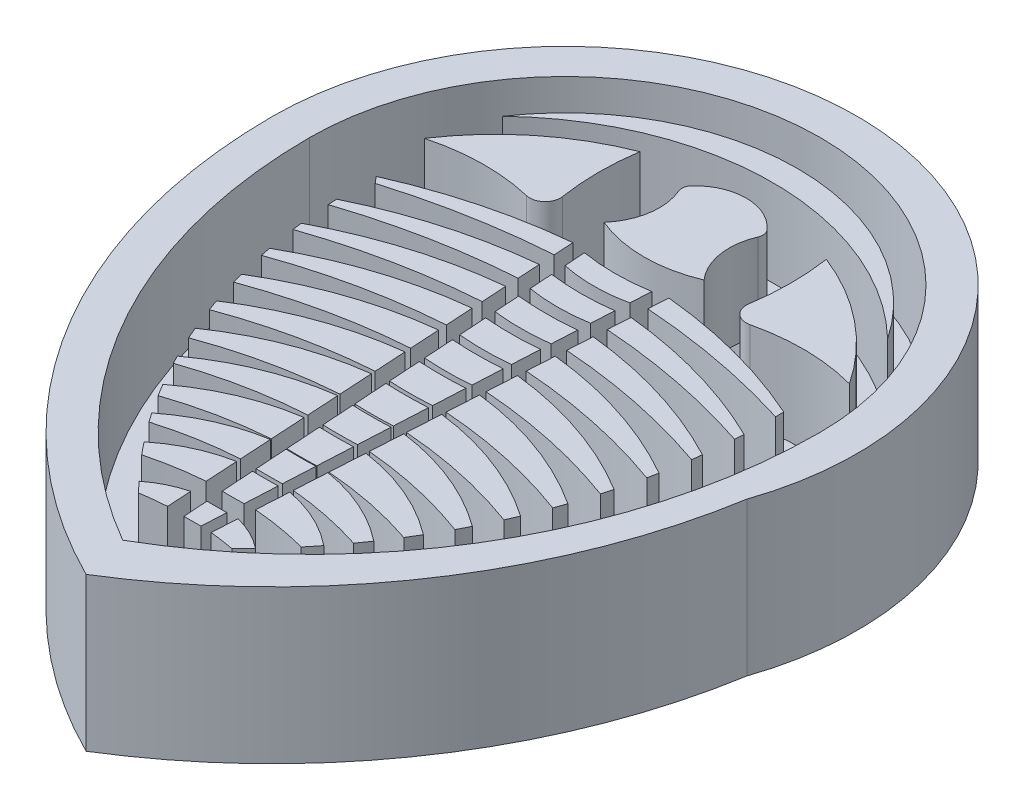
from build123d import *

# Parameters (mm, degrees)
P_IDAT_VYSUNUT_M1_DEPTH = 1
P_IDAT_VYSUNUT_M2_DEPTH = 1.7
BOSS_EXTRUDE1_START     = -3
BOSS_EXTRUDE1_DEPTH     = 3


with BuildPart() as part:
    # Skica1 → Přidat vysunutím1 (new body)
    with BuildSketch(Plane(origin=(0, 0, 0), x_dir=(1, 0, 0), z_dir=(0, 1, 0))):
        with BuildLine():
            ThreePointArc((5, 0), (0, 5), (-5, 0))
            ThreePointArc((-5, 0), (-3.660254038, -5), (0, -8.660254038))
            ThreePointArc((0, -8.660254038), (3.660254038, -5), (5, 0))
        make_face()
        with BuildLine():
            Line((3.521195323, 0.745878365), (3.521195323, -1.05683578))
            ThreePointArc((3.521195323, -1.05683578), (2.665209016, -2.296570998), (2.915739681, -3.782131617))
            Line((2.915739681, -3.782131617), (1.735980446, -4.961890852))
            ThreePointArc((1.735980446, -4.961890852), (1.139962306, -1.642409891), (3.521195323, 0.745878365))
        make_face(mode=Mode.SUBTRACT)
        with BuildLine():
            Line((-3.48910503, 0.731222327), (-3.48910503, -1.078343694))
            ThreePointArc((-3.48910503, -1.078343694), (-2.661110904, -2.315447133), (-2.915739681, -3.782131617))
            Line((-2.915739681, -3.782131617), (-1.73892928, -4.958942018))
            ThreePointArc((-1.73892928, -4.958942018), (-1.138801933, -1.660114444), (-3.48910503, 0.731222327))
        make_face(mode=Mode.SUBTRACT)
        with BuildLine():
            Line((-3.414438811, 2.046085464), (3.4576005, 2.046085464))
            add(Edge.make_bspline(
                [(-3.414438811, 2.046085464), (0.01913173, 3.731570771), (3.4576005, 2.046085464)],
                knots=[0, 0, 0, 1, 1, 1], degree=2))
        make_face(mode=Mode.SUBTRACT)
    extrude(amount=-P_IDAT_VYSUNUT_M1_DEPTH)

    # Skica2 → Přidat vysunutím2 (add)
    with BuildSketch(Plane(origin=(0, 0, 0), x_dir=(1, 0, 0), z_dir=(0, 1, 0))):
        with BuildLine():
            ThreePointArc((-0.435047938, -7.348056278), (-0.69047942, -7.370211218), (-0.944547646, -7.404641136))
            ThreePointArc((-0.944547646, -7.404641136), (-1.044053725, -7.303235817), (-1.142178643, -7.200493427))
            ThreePointArc((-1.142178643, -7.200493427), (-0.820283032, -6.998144282), (-0.463870567, -6.865735387))
            Line((-0.463870567, -6.865735387), (-0.435047938, -7.348056278))
        make_face()
        with BuildLine():
            ThreePointArc((-0.48311443, -6.543706568), (-1.026754601, -6.611177456), (-1.56220985, -6.726869431))
            ThreePointArc((-1.56220985, -6.726869431), (-1.662000146, -6.605433643), (-1.759961506, -6.482517714))
            ThreePointArc((-1.759961506, -6.482517714), (-1.175976189, -6.119175526), (-0.52103385, -5.909159033))
            Line((-0.52103385, -5.909159033), (-0.48311443, -6.543706568))
        make_face()
        with BuildLine():
            ThreePointArc((-0.525801188, -5.829381897), (-1.294271561, -5.920788208), (-2.04750967, -6.098366866))
            ThreePointArc((-2.04750967, -6.098366866), (-2.111177401, -6.008129807), (-2.173892527, -5.917228103))
            ThreePointArc((-2.173892527, -5.917228103), (-1.413947855, -5.458574562), (-0.563062791, -5.205842323))
            Line((-0.563062791, -5.205842323), (-0.525801188, -5.829381897))
        make_face()
        with BuildLine():
            ThreePointArc((-0.564221505, -5.186452286), (-1.496899189, -5.31618491), (-2.405948876, -5.561840938))
            ThreePointArc((-2.405948876, -5.561840938), (-2.47902439, -5.443080103), (-2.550516325, -5.323359302))
            ThreePointArc((-2.550516325, -5.323359302), (-1.630072172, -4.78948348), (-0.605000226, -4.504056891))
            Line((-0.605000226, -4.504056891), (-0.564221505, -5.186452286))
        make_face()
        with BuildLine():
            ThreePointArc((-0.609681174, -4.425725417), (-1.722246967, -4.57062129), (-2.804865412, -4.865128946))
            ThreePointArc((-2.804865412, -4.865128946), (-2.846957116, -4.783763443), (-2.888337343, -4.702033808))
            ThreePointArc((-2.888337343, -4.702033808), (-1.82385638, -4.112337163), (-0.646885649, -3.803141834))
            Line((-0.646885649, -3.803141834), (-0.609681174, -4.425725417))
        make_face()
        with BuildLine():
            ThreePointArc((-0.649768137, -3.75490598), (-1.886992142, -3.932901443), (-3.087237062, -4.281925446))
            ThreePointArc((-3.087237062, -4.281925446), (-3.137074616, -4.168548051), (-3.185571439, -4.054590719))
            ThreePointArc((-3.185571439, -4.054590719), (-1.994758332, -3.427574113), (-0.688738665, -3.102769081))
            Line((-0.688738665, -3.102769081), (-0.649768137, -3.75490598))
        make_face()
        with BuildLine():
            ThreePointArc((-0.693500935, -3.023076761), (-2.048697762, -3.217851436), (-3.362758833, -3.602219899))
            ThreePointArc((-3.362758833, -3.602219899), (-3.402116283, -3.492576859), (-3.440254888, -3.38250392))
            ThreePointArc((-3.440254888, -3.38250392), (-2.142176753, -2.735637699), (-0.730570119, -2.40275715))
            Line((-0.730570119, -2.40275715), (-0.693500935, -3.023076761))
        make_face()
        with BuildLine():
            ThreePointArc((-0.737644723, -2.28436999), (-2.186526172, -2.490583797), (-3.592127328, -2.898096962))
            ThreePointArc((-3.592127328, -2.898096962), (-3.621750205, -2.792878944), (-3.650276137, -2.687358247))
            ThreePointArc((-3.650276137, -2.687358247), (-2.265442062, -2.036978997), (-0.772386499, -1.70299746))
            Line((-0.772386499, -1.70299746), (-0.737644723, -2.28436999))
        make_face()
        with BuildLine():
            ThreePointArc((-0.782080688, -1.540773892), (-2.299279672, -1.75301782), (-3.773049464, -2.17127951))
            ThreePointArc((-3.773049464, -2.17127951), (-3.793701377, -2.071161983), (-3.813377604, -1.970848141))
            ThreePointArc((-3.813377604, -1.970848141), (-2.363805986, -1.33206045), (-0.814191928, -1.003421043))
            Line((-0.814191928, -1.003421043), (-0.782080688, -1.540773892))
        make_face()
        with BuildLine():
            ThreePointArc((-0.871479662, -0.044762094), (-2.444698783, -0.253257558), (-3.979415358, -0.657155804))
            ThreePointArc((-3.979415358, -0.657155804), (-3.984562694, -0.569161766), (-3.988971171, -0.481127617))
            ThreePointArc((-3.988971171, -0.481127617), (-2.482365461, 0.094622416), (-0.897780057, 0.395351462))
            Line((-0.897780057, 0.395351462), (-0.871479662, -0.044762094))
        make_face()
        with BuildLine():
            Line((-0.916308941, 0.705415762), (-0.939566009, 1.094601969))
            ThreePointArc((-0.939566009, 1.094601969), (-2.496070066, 0.816540474), (-3.987598771, 0.291787966))
            ThreePointArc((-3.987598771, 0.291787966), (-3.93376434, 0.226933977), (-3.878875249, 0.162970131))
            ThreePointArc((-3.878875249, 0.162970131), (-2.412884098, 0.517710206), (-0.916308941, 0.705415762))
        make_face()
        with BuildLine():
            ThreePointArc((-2.188227529, 1.437501174), (-3.177280617, 1.546631075), (-4.162667451, 1.408254291))
            ThreePointArc((-4.162667451, 1.408254291), (-3.13913069, 2.530148747), (-1.826006026, 3.293023761))
            ThreePointArc((-1.826006026, 3.293023761), (-1.881947184, 2.534148909), (-1.822084639, 1.775573316))
            ThreePointArc((-1.822084639, 1.775573316), (-1.914977273, 1.508870723), (-2.188227529, 1.437501174))
        make_face()
        with BuildLine():
            ThreePointArc((3.772330851, 2.547069838), (0, 4.070537807), (-3.772330851, 2.547069838))
            ThreePointArc((-3.772330851, 2.547069838), (0, 4.5517079), (3.772330851, 2.547069838))
        make_face()
        with BuildLine():
            ThreePointArc((0.777989506, 3.004550275), (0.791260451, 3.115919535), (0.7424957, 3.216920669))
            ThreePointArc((0.7424957, 3.216920669), (0, 3.547069838), (-0.7424957, 3.216920669))
            ThreePointArc((-0.7424957, 3.216920669), (-0.791260451, 3.115919535), (-0.777989506, 3.004550275))
            ThreePointArc((-0.777989506, 3.004550275), (-0.696842448, 2.345663458), (-0.978400549, 1.744463226))
            ThreePointArc((-0.978400549, 1.744463226), (0, 1.547069838), (0.978400549, 1.744463226))
            ThreePointArc((0.978400549, 1.744463226), (0.696842448, 2.345663458), (0.777989506, 3.004550275))
        make_face()
        with BuildLine():
            ThreePointArc((1.822084639, 1.775573316), (1.881947184, 2.534148909), (1.826006026, 3.293023761))
            ThreePointArc((1.826006026, 3.293023761), (3.13913069, 2.530148747), (4.162667451, 1.408254291))
            ThreePointArc((4.162667451, 1.408254291), (3.177280617, 1.546631075), (2.188227529, 1.437501174))
            ThreePointArc((2.188227529, 1.437501174), (1.914977273, 1.508870723), (1.822084639, 1.775573316))
        make_face()
        with BuildLine():
            Line((-0.653856014, 1.036744977), (-0.627177875, 0.627948759))
            ThreePointArc((-0.627177875, 0.627948759), (0.007047348, 0.561342071), (0.640951077, 0.630941981))
            Line((0.640951077, 0.630941981), (0.662066926, 1.038108349))
            ThreePointArc((0.662066926, 1.038108349), (0.004161666, 0.983172801), (-0.653856014, 1.036744977))
        make_face()
        with BuildLine():
            ThreePointArc((-0.608930115, 0.348333492), (0.008819368, 0.30865484), (0.626415299, 0.350655846))
            Line((0.626415299, 0.350655846), (0.60307309, -0.099440312))
            ThreePointArc((0.60307309, -0.099440312), (0.011961322, -0.148953749), (-0.579458539, -0.103267301))
            Line((-0.579458539, -0.103267301), (-0.608930115, 0.348333492))
        make_face()
        with BuildLine():
            Line((-0.563817169, -0.342944183), (-0.531393318, -0.839783468))
            ThreePointArc((-0.531393318, -0.839783468), (0.016881591, -0.871818687), (0.56489573, -0.835595287))
            Line((0.56489573, -0.835595287), (0.590594924, -0.34005056))
            ThreePointArc((0.590594924, -0.34005056), (0.013466822, -0.372593507), (-0.563817169, -0.342944183))
        make_face()
        with BuildLine():
            Line((-0.518578705, -1.036145198), (-0.483230171, -1.577800173))
            ThreePointArc((-0.483230171, -1.577800173), (0.021803285, -1.600485761), (0.526626446, -1.573522766))
            Line((0.526626446, -1.573522766), (0.554661515, -1.032936542))
            ThreePointArc((0.554661515, -1.032936542), (0.018112597, -1.058353296), (-0.518578705, -1.036145198))
        make_face()
        with BuildLine():
            Line((-0.473249622, -1.730734777), (-0.435139253, -2.3147101))
            ThreePointArc((-0.435139253, -2.3147101), (0.026715844, -2.330778107), (0.488405798, -2.310512426))
            Line((0.488405798, -2.310512426), (0.518646873, -1.727388889))
            ThreePointArc((0.518646873, -1.727388889), (0.022760192, -1.747313378), (-0.473249622, -1.730734777))
        make_face()
        with BuildLine():
            Line((-0.42785002, -2.42640495), (-0.387270501, -3.048215708))
            ThreePointArc((-0.387270501, -3.048215708), (0.031606302, -3.059500446), (0.45035596, -3.044208443))
            Line((0.45035596, -3.044208443), (0.482569539, -2.423050098))
            ThreePointArc((0.482569539, -2.423050098), (0.027411133, -2.438668883), (-0.42785002, -2.42640495))
        make_face()
        with BuildLine():
            Line((-0.382390558, -3.122992379), (-0.339782943, -3.775880184))
            ThreePointArc((-0.339782943, -3.775880184), (0.036459149, -3.783668202), (0.412605163, -3.77213821))
            Line((0.412605163, -3.77213821), (0.446439681, -3.119724092))
            ThreePointArc((0.446439681, -3.119724092), (0.032066228, -3.131924709), (-0.382390558, -3.122992379))
        make_face()
        with BuildLine():
            Line((-0.336874511, -3.820446857), (-0.296212988, -4.443514195))
            ThreePointArc((-0.296212988, -4.443514195), (0.040912963, -4.448897986), (0.377966169, -4.440064623))
            Line((0.377966169, -4.440064623), (0.410261069, -3.817338207))
            ThreePointArc((0.410261069, -3.817338207), (0.036726185, -3.826801141), (-0.336874511, -3.820446857))
        make_face()
        with BuildLine():
            Line((-0.291297367, -4.51883756), (-0.246767591, -5.20117915))
            ThreePointArc((-0.246767591, -5.20117915), (0.045968856, -5.204538098), (0.338653865, -5.198104154))
            Line((0.338653865, -5.198104154), (0.374030936, -4.51594575))
            ThreePointArc((0.374030936, -4.51594575), (0.041392047, -4.523203734), (-0.291297367, -4.51883756))
        make_face()
        with BuildLine():
            Line((-0.245643058, -5.218410675), (-0.20495555, -5.841876176))
            ThreePointArc((-0.20495555, -5.841876176), (0.050245349, -5.843978529), (0.305409141, -5.839145549))
            Line((0.305409141, -5.839145549), (0.337737111, -5.215781462))
            ThreePointArc((0.337737111, -5.215781462), (0.046065788, -5.221258982), (-0.245643058, -5.218410675))
        make_face()
        with BuildLine():
            Line((-0.199872475, -5.919765477), (-0.158480757, -6.55402178))
            ThreePointArc((-0.158480757, -6.55402178), (0.054999827, -6.555115225), (0.268455851, -6.551697388))
            Line((0.268455851, -6.551697388), (0.301348943, -5.917436324))
            ThreePointArc((0.301348943, -5.917436324), (0.050751597, -5.92147661), (-0.199872475, -5.919765477))
        make_face()
        with BuildLine():
            Line((-0.137598784, -6.8740018), (-0.106128968, -7.356222162))
            ThreePointArc((-0.106128968, -7.356222162), (0.060356742, -7.356571612), (0.226828381, -7.354379088))
            Line((0.226828381, -7.354379088), (0.251838147, -6.872128272))
            ThreePointArc((0.251838147, -6.872128272), (0.057127362, -6.874661622), (-0.137598784, -6.8740018))
        make_face()
        with BuildLine():
            ThreePointArc((0.913565558, -7.435660409), (0.674611597, -7.394792085), (0.434044566, -7.364846815))
            Line((0.434044566, -7.364846815), (0.463870567, -6.865735387))
            ThreePointArc((0.463870567, -6.865735387), (0.820283032, -6.998144282), (1.142178643, -7.200493427))
            ThreePointArc((1.142178643, -7.200493427), (1.028790357, -7.318969583), (0.913565558, -7.435660409))
        make_face()
        with BuildLine():
            ThreePointArc((1.56220985, -6.726869431), (1.026754601, -6.611177456), (0.48311443, -6.543706568))
            Line((0.48311443, -6.543706568), (0.52103385, -5.909159033))
            ThreePointArc((0.52103385, -5.909159033), (1.175976189, -6.119175526), (1.759961506, -6.482517714))
            ThreePointArc((1.759961506, -6.482517714), (1.662000146, -6.605433643), (1.56220985, -6.726869431))
        make_face()
        with BuildLine():
            ThreePointArc((2.009972467, -6.150639692), (1.275900679, -5.956649098), (0.524857999, -5.84516532))
            Line((0.524857999, -5.84516532), (0.563062791, -5.205842323))
            ThreePointArc((0.563062791, -5.205842323), (1.413947855, -5.458574562), (2.173892527, -5.917228103))
            ThreePointArc((2.173892527, -5.917228103), (2.092725079, -6.034490511), (2.009972467, -6.150639692))
        make_face()
        with BuildLine():
            ThreePointArc((2.405948876, -5.561840938), (1.496899189, -5.31618491), (0.564221505, -5.186452286))
            Line((0.564221505, -5.186452286), (0.605000226, -4.504056891))
            ThreePointArc((0.605000226, -4.504056891), (1.630072172, -4.78948348), (2.550516325, -5.323359302))
            ThreePointArc((2.550516325, -5.323359302), (2.47902439, -5.443080103), (2.405948876, -5.561840938))
        make_face()
        with BuildLine():
            ThreePointArc((2.77208347, -4.927318553), (1.70684421, -4.611105365), (0.608773859, -4.440908528))
            Line((0.608773859, -4.440908528), (0.646885649, -3.803141834))
            ThreePointArc((0.646885649, -3.803141834), (1.82385638, -4.112337163), (2.888337343, -4.702033808))
            ThreePointArc((2.888337343, -4.702033808), (2.83089034, -4.815027047), (2.77208347, -4.927318553))
        make_face()
        with BuildLine():
            ThreePointArc((3.087237062, -4.281925446), (1.886992142, -3.932901443), (0.649768137, -3.75490598))
            Line((0.649768137, -3.75490598), (0.688738665, -3.102769081))
            ThreePointArc((0.688738665, -3.102769081), (1.994758332, -3.427574113), (3.185571439, -4.054590719))
            ThreePointArc((3.185571439, -4.054590719), (3.137074616, -4.168548051), (3.087237062, -4.281925446))
        make_face()
        with BuildLine():
            ThreePointArc((3.362758833, -3.602219899), (2.048697762, -3.217851436), (0.693500935, -3.023076761))
            Line((0.693500935, -3.023076761), (0.730570119, -2.40275715))
            ThreePointArc((0.730570119, -2.40275715), (2.142176753, -2.735637699), (3.440254888, -3.38250392))
            ThreePointArc((3.440254888, -3.38250392), (3.402116283, -3.492576859), (3.362758833, -3.602219899))
        make_face()
        with BuildLine():
            ThreePointArc((3.592127328, -2.898096962), (2.186526172, -2.490583797), (0.737644723, -2.28436999))
            Line((0.737644723, -2.28436999), (0.772386499, -1.70299746))
            ThreePointArc((0.772386499, -1.70299746), (2.265442062, -2.036978997), (3.650276137, -2.687358247))
            ThreePointArc((3.650276137, -2.687358247), (3.621750205, -2.792878944), (3.592127328, -2.898096962))
        make_face()
        with BuildLine():
            ThreePointArc((3.773049464, -2.17127951), (2.299279672, -1.75301782), (0.782080688, -1.540773892))
            Line((0.782080688, -1.540773892), (0.814191928, -1.003421043))
            ThreePointArc((0.814191928, -1.003421043), (2.363805986, -1.33206045), (3.813377604, -1.970848141))
            ThreePointArc((3.813377604, -1.970848141), (3.793701377, -2.071161983), (3.773049464, -2.17127951))
        make_face()
        with BuildLine():
            ThreePointArc((3.903042076, -1.423627611), (2.385752794, -1.006769816), (0.826716789, -0.793828702))
            Line((0.826716789, -0.793828702), (0.855989148, -0.303981988))
            ThreePointArc((0.855989148, -0.303981988), (2.436429093, -0.621360254), (3.927142449, -1.234787575))
            ThreePointArc((3.927142449, -1.234787575), (3.915520245, -1.329262214), (3.903042076, -1.423627611))
        make_face()
        with BuildLine():
            ThreePointArc((3.979415358, -0.657155804), (2.444698783, -0.253257558), (0.871479662, -0.044762094))
            Line((0.871479662, -0.044762094), (0.897780057, 0.395351462))
            ThreePointArc((0.897780057, 0.395351462), (2.482365461, 0.094622416), (3.988971171, -0.481127617))
            ThreePointArc((3.988971171, -0.481127617), (3.984562694, -0.569161766), (3.979415358, -0.657155804))
        make_face()
        with BuildLine():
            ThreePointArc((-0.855989148, -0.303981988), (-2.436429093, -0.621360254), (-3.927142449, -1.234787575))
            ThreePointArc((-3.927142449, -1.234787575), (-3.915520245, -1.329262214), (-3.903042076, -1.423627611))
            ThreePointArc((-3.903042076, -1.423627611), (-2.385752794, -1.006769816), (-0.826716789, -0.793828702))
            Line((-0.826716789, -0.793828702), (-0.855989148, -0.303981988))
        make_face()
        with BuildLine():
            ThreePointArc((3.999244676, 0.125941382), (2.474795846, 0.50622373), (0.916308941, 0.705415762))
            Line((0.916308941, 0.705415762), (0.939566009, 1.094601969))
            ThreePointArc((0.939566009, 1.094601969), (2.500543522, 0.815361092), (3.996049018, 0.288019105))
            ThreePointArc((3.996049018, 0.288019105), (3.997959641, 0.206986411), (3.999244676, 0.125941382))
        make_face()
    extrude(amount=P_IDAT_VYSUNUT_M2_DEPTH)

    # Sketch1 → Boss-Extrude1 (add)
    with BuildSketch(Plane.XZ.offset(1).offset(BOSS_EXTRUDE1_START)):
        with BuildLine():
            ThreePointArc((-5.722461986, 0), (0.938853651, -5.644920283), (5.414396618, 1.8522636))
            ThreePointArc((5.414396618, 1.8522636), (3.655025868, 6.286749681), (0.221158993, 9.598638949))
            ThreePointArc((0.221158993, 9.598638949), (-4.116252851, 5.644920283), (-5.722461986, 0))
        make_face()
        with BuildLine():
            ThreePointArc((5, 0), (3.660254038, 5), (0, 8.660254038))
            ThreePointArc((0, 8.660254038), (-3.660254038, 5), (-5, 0))
            ThreePointArc((-5, 0), (0, -5), (5, 0))
        make_face(mode=Mode.SUBTRACT)
    extrude(amount=BOSS_EXTRUDE1_DEPTH)


solid = part.part
